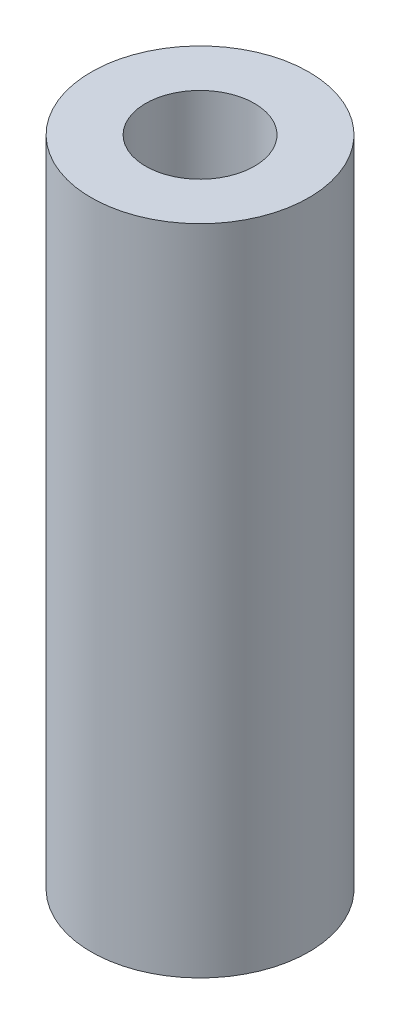
from build123d import *

# Parameters (mm, degrees)
SKETCH1_R           = 6.35
SKETCH1_R_2         = 3.175
BOSS_EXTRUDE1_DEPTH = 38.1


with BuildPart() as part:
    # Sketch1 → Boss-Extrude1 (new body)
    with BuildSketch(Plane(origin=(0, 0, 0), x_dir=(1, 0, 0), z_dir=(0, 1, 0))):
        with Locations(Location((0, 0, 0), (0, 0, 90))):
            Circle(SKETCH1_R)
        with Locations(Location((0, 0, 0), (0, 0, 90))):
            Circle(SKETCH1_R_2, mode=Mode.SUBTRACT)
    extrude(amount=BOSS_EXTRUDE1_DEPTH)


solid = part.part
